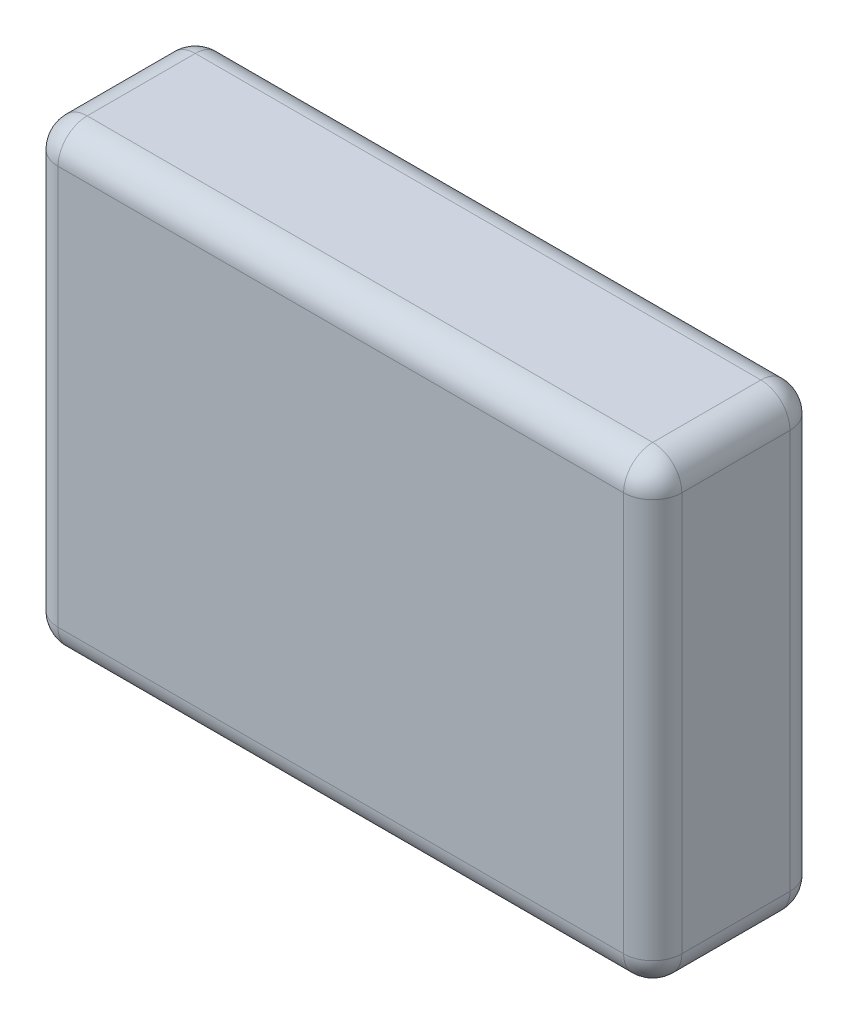
from build123d import *

# Parameters (mm, degrees)
SKETCH1_W           = 750
SKETCH1_H           = 550
BOSS_EXTRUDE1_DEPTH = 200
FILLET1_R           = 35


with BuildPart() as part:
    # Sketch1 → Boss-Extrude1 (new body)
    with BuildSketch(Plane.XY):
        with Locations((375, 275)):
            Rectangle(SKETCH1_W, SKETCH1_H)
    extrude(amount=BOSS_EXTRUDE1_DEPTH)

    # Fillet1
    fillet1_edges = [part.edges().sort_by_distance(p)[0] for p in [
        (750, 275, 200),
        (375, 550, 200),
        (0, 275, 200),
        (375, 550, 0),
        (750, 275, 0),
        (375, 0, 0),
        (0, 275, 0),
        (375, 0, 200),
        (0, 550, 100),
        (750, 550, 100),
        (750, 0, 100),
        (0, 0, 100),
    ]]
    fillet(fillet1_edges, radius=FILLET1_R)


solid = part.part
